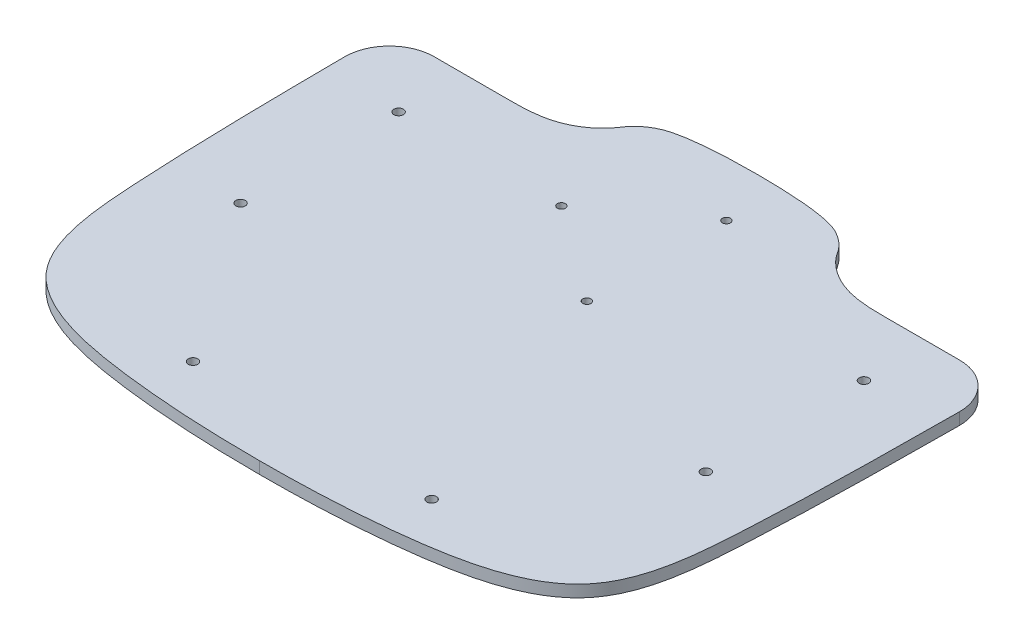
from build123d import *

# Parameters (mm, degrees)
SKETCH1_W           = 240
SKETCH1_H           = 310
BOSS_EXTRUDE1_DEPTH = 4
CUT_EXTRUDE1_START  = -4
CUT_EXTRUDE1_DEPTH  = 4
SKETCH3_W           = 240
SKETCH3_H           = 155
CUT_EXTRUDE2_DEPTH  = 197.06376528
SKETCH14_R          = 1.6
CUT_EXTRUDE10_DEPTH = 197.06376528
BOSS_EXTRUDE3_DEPTH = 4
CUT_EXTRUDE11_DEPTH = 197.06376528
FILLET2_R           = 15
SKETCH18_R          = 1.35
CUT_EXTRUDE12_DEPTH = 10


with BuildPart() as part:
    # Sketch1 → Boss-Extrude1 (new body)
    with BuildSketch(Plane(origin=(0, 0, 0), x_dir=(1, 0, 0), z_dir=(0, 1, 0))):
        Rectangle(SKETCH1_W, SKETCH1_H)
    extrude(amount=BOSS_EXTRUDE1_DEPTH)

    # Sketch2 → Cut-Extrude1 (cut)
    with BuildSketch(Plane(origin=(0, 4, 0), x_dir=(1, 0, 0), z_dir=(0, 1, 0)).offset(CUT_EXTRUDE1_START)):
        with BuildLine():
            add(Edge.make_bspline(
                [(0, -155), (-30.572222193, -155), (-80.343316982, -153.733320995), (-119.221157946, -117.654395612), (-120, -45.41001223), (-120, 0)],
                knots=[0, 0, 0, 0, 0.458017491, 0.558017491, 1, 1, 1, 1], degree=3))
            Line((-120, 0), (-120, -155))
            Line((-120, -155), (0, -155))
        make_face()
        with BuildLine():
            Line((120, -155), (120, 0))
            add(Edge.make_bspline(
                [(0, -155), (30.572222193, -155), (80.343316982, -153.733320995), (119.221157946, -117.654395612), (120, -45.41001223), (120, 0)],
                knots=[0, 0, 0, 0, 0.458017491, 0.558017491, 1, 1, 1, 1], degree=3))
            Line((0, -155), (120, -155))
        make_face()
    extrude(amount=CUT_EXTRUDE1_DEPTH, mode=Mode.SUBTRACT)

    # Sketch3 → Cut-Extrude2 (cut, through all)
    with BuildSketch(Plane(origin=(0, 4, 0), x_dir=(1, 0, 0), z_dir=(0, 1, 0))):
        with Locations((0, 77.5)):
            Rectangle(SKETCH3_W, SKETCH3_H)
    extrude(amount=-CUT_EXTRUDE2_DEPTH, mode=Mode.SUBTRACT)

    # Sketch14 → Cut-Extrude10 (cut, through all)
    with BuildSketch(Plane(origin=(0, 4, 0), x_dir=(1, 0, 0), z_dir=(0, 1, 0))):
        with Locations(Location((78, -75, 0), (0, 0, 270))):
            Circle(SKETCH14_R)
        with Locations(Location((78, -22, 0), (0, 0, 270))):
            Circle(SKETCH14_R)
        with Locations(Location((40, -128.95, 0), (0, 0, 270))):
            Circle(SKETCH14_R)
        with Locations(Location((-40, -128.95, 0), (0, 0, 90))):
            Circle(SKETCH14_R)
        with Locations(Location((-78, -75, 0), (0, 0, 90))):
            Circle(SKETCH14_R)
        with Locations(Location((-78, -22, 0), (0, 0, 90))):
            Circle(SKETCH14_R)
    extrude(amount=-CUT_EXTRUDE10_DEPTH, mode=Mode.SUBTRACT)

    # Sketch16 → Boss-Extrude3 (add, through all)
    with BuildSketch(Plane(origin=(0, 4, 0), x_dir=(1, 0, 0), z_dir=(0, 1, 0))):
        with BuildLine():
            Line((-62.5, 0), (62.5, 0))
            add(Edge.make_bspline(
                [(62.5, 0), (56.859259916, 0), (47.566912037, 0.719259662), (37.247807044, 7.965019714), (35.011733166, 13.706266708), (25.174107504, 19.099129057), (11.46146494, 20), (0, 20)],
                knots=[0, 0, 0, 0, 0.283628686, 0.580942943, 0.775947596, 0.817853301, 1, 1, 1, 1], degree=3))
            add(Edge.make_bspline(
                [(-62.5, 0), (-56.859259916, 0), (-47.566912037, 0.719259662), (-37.247807044, 7.965019714), (-35.011733166, 13.706266708), (-25.174107504, 19.099129057), (-11.46146494, 20), (0, 20)],
                knots=[0, 0, 0, 0, 0.283628686, 0.580942943, 0.775947596, 0.817853301, 1, 1, 1, 1], degree=3))
        make_face()
    extrude(amount=-BOSS_EXTRUDE3_DEPTH)

    # Sketch17 → Cut-Extrude11 (cut, through all)
    with BuildSketch(Plane(origin=(0, 4, 0), x_dir=(1, 0, 0), z_dir=(0, 1, 0))):
        with BuildLine():
            Line((103.110137058, 0), (120, 0))
            add(Edge.make_bspline(
                [(0, -155), (30.572222193, -155), (80.343316982, -153.733320995), (119.221157946, -117.654395612), (120, -45.41001223), (120, 0)],
                knots=[0, 0, 0, 0, 0.458017491, 0.558017491, 1, 1, 1, 1], degree=3))
            add(Edge.make_bspline(
                [(0, -155), (-30.572222193, -155), (-80.343316982, -153.733320995), (-119.221157946, -117.654395612), (-120, -45.41001223), (-120, 0)],
                knots=[0, 0, 0, 0, 0.458017491, 0.558017491, 1, 1, 1, 1], degree=3))
            Line((-120, 0), (-103.110137058, 0))
            add(Edge.make_bspline(
                [(0, -146.590313569), (-13.459917165, -146.590313569), (-46.754245971, -145.639494105), (-97.960421981, -134.567499832), (-102.124246572, -80.871354335), (-102.923272875, -39.746916924), (-103.110137058, -11.568258696), (-103.110137058, 0)],
                knots=[0, 0, 0, 0, 0.214534577, 0.42370435, 0.615344084, 0.849411098, 1, 1, 1, 1], degree=3))
            add(Edge.make_bspline(
                [(0, -146.590313569), (13.459917165, -146.590313569), (46.754245971, -145.639494105), (97.960421981, -134.567499832), (102.124246572, -80.871354335), (102.923272875, -39.746916924), (103.110137058, -11.568258696), (103.110137058, 0)],
                knots=[0, 0, 0, 0, 0.214534577, 0.42370435, 0.615344084, 0.849411098, 1, 1, 1, 1], degree=3))
        make_face()
    extrude(amount=-CUT_EXTRUDE11_DEPTH, mode=Mode.SUBTRACT)

    # Fillet2
    fillet2_edges = [part.edges().sort_by_distance(p)[0] for p in [
        (103.110137058, 2, 0),
        (-103.110137058, 2, 0),
    ]]
    fillet(fillet2_edges, radius=FILLET2_R)

    # Sketch18 → Cut-Extrude12 (cut)
    with BuildSketch(Plane(origin=(0, 4, 0), x_dir=(1, 0, 0), z_dir=(0, 1, 0))):
        with Locations(Location((8.5, 1.4, 0), (0, 0, 270))):
            Circle(SKETCH18_R)
        with Locations(Location((8.5, -45.4, 0), (0, 0, 270))):
            Circle(SKETCH18_R)
        with Locations(Location((-23.42, -22, 0), (0, 0, 270))):
            Circle(SKETCH18_R)
    extrude(amount=-CUT_EXTRUDE12_DEPTH, mode=Mode.SUBTRACT)


solid = part.part
